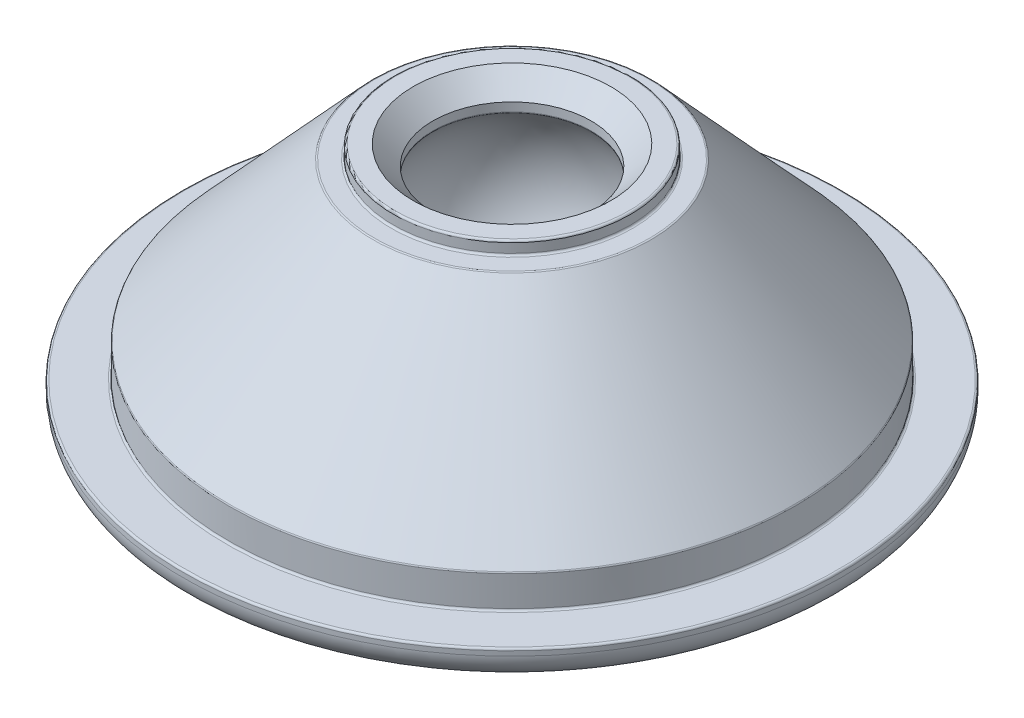
from build123d import *

# Parameters (mm, degrees)
FILLET1_R     = 2
FILLET2_R     = 0.15
CHAMFER1_SIZE = 1.5


with BuildPart() as part:
    # Sketch1 → Revolve1 (revolve)
    with BuildSketch(Plane.XY):
        with BuildLine():
            Line((-25, 0), (-21.5, 0))
            Line((-21.5, 0), (-21.5, 2.5))
            Line((-21.5, 2.5), (-10.5, 14.5))
            Line((-10.5, 14.5), (-9, 14.5))
            Line((-9, 14.5), (-9, 15.5))
            Line((-9, 15.5), (-6, 15.5))
            Line((-6, 15.5), (-6, 13.291502622))
            ThreePointArc((-6, 13.291502622), (-7.291502622, 4.708497378), (0, 0))
            Line((0, 0), (0, -2.5))
            ThreePointArc((0, -2.5), (-8.551098399, 1.906666252), (-9.924704088, 11.427863587))
            Line((-9.924704088, 11.427863587), (-19, 1.527540774))
            Line((-19, 1.527540774), (-19, -2.5))
            Line((-19, -2.5), (-25, -2.5))
            Line((-25, -2.5), (-25, 0))
        make_face()
    revolve(axis=Axis((0, 15.5, 0), (0, -1, 0)))

    # Fillet1
    fillet1_edges = [part.edges().sort_by_distance(p)[0] for p in [
        (19, -2.5, 0),
        (25, -2.5, 0),
    ]]
    fillet(fillet1_edges, radius=FILLET1_R)

    # Fillet2
    fillet2_edges = [part.edges().sort_by_distance(p)[0] for p in [
        (25, 0, 0),
        (21.5, 0, 0),
        (21.5, 2.5, 0),
        (10.5, 14.5, 0),
        (9, 14.5, 0),
        (9, 15.5, 0),
        (6, 13.291502622, 0),
        (19, 1.527540774, 0),
    ]]
    fillet(fillet2_edges, radius=FILLET2_R)

    # Chamfer1
    chamfer1_edges = [part.edges().sort_by_distance(p)[0] for p in [
        (6, 15.5, 0),
    ]]
    chamfer(chamfer1_edges, length=CHAMFER1_SIZE)


solid = part.part
